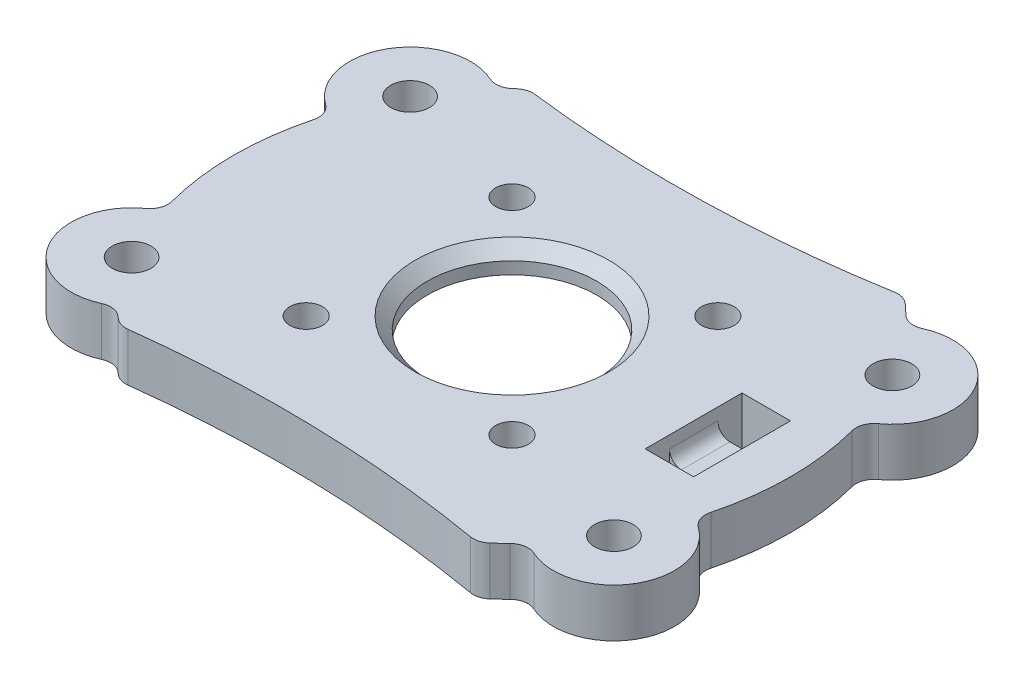
from build123d import *

# Parameters (mm, degrees)
SKETCH_1_R               = 23
SKETCH_1_R_2             = 13.6
SKETCH_1_R_3             = 5
EXTRUDE_1_DEPTH          = 4
CUT_EXTRUDE_1_DEPTH      = 4
PATTERN_CIRCULAR_1_COUNT = 2
CUT_EXTRUDE_START        = -10
CUT_EXTRUDE_2_DEPTH      = 10
FILLET_1_R               = 1.5
SKETCH_4_R               = 13.6
EXTRUDE_2_DEPTH          = 4
SKETCH_5_R               = 12.070826334
EXTRUDE_3_DEPTH          = 2
SKETCH_6_R               = 0.9
CUT_EXTRUDE_3_DEPTH      = 2
CUT_EXTRUDE_4_DEPTH      = 4.5
SKETCH_8_W               = 4
SKETCH_8_H               = 2
CUT_EXTRUDE_5_DEPTH      = 22
SKETCH_9_W               = 4
SKETCH_9_H               = 8
CUT_EXTRUDE_6_DEPTH      = 2
FILLET_2_R               = 1
FILLET_5_R               = 1.5
SKETCH_12_R              = 7
CUT_EXTRUDE_8_DEPTH      = 10
SKETCH_13_R              = 7
EXTRUDE_4_DEPTH          = 2
EXTRUDE_5_DEPTH          = 4
CHAMFER_1_SIZE           = 1
CUT_EXTRUDE_9_DEPTH      = 10
PATTERN_CIRCULAR_2_COUNT = 4
SKETCH_16_W              = 23.3
SKETCH_16_H              = 23.3
CUT_EXTRUDE_10_DEPTH     = 2
FILLET_6_R               = 2.9


with BuildPart() as part:
    # 草图1 → 凸台-拉伸1 (new body)
    # profile 1 of 5: a face of its own
    with BuildSketch(Plane(origin=(0, 0, 0), x_dir=(1, 0, 0), z_dir=(0, 1, 0))):
        Circle(SKETCH_1_R)
        with Locations(Location((0, 0, 0), (0, 0, 270))):
            Circle(SKETCH_1_R_2, mode=Mode.SUBTRACT)
    # profile 2 of 5: a face of its own
    with BuildSketch(Plane(origin=(0, 0, 0), x_dir=(1, 0, 0), z_dir=(0, 1, 0))):
        with Locations((-19.918584287, -11.5)):
            Circle(SKETCH_1_R_3)
    # profile 3 of 5: a face of its own
    with BuildSketch(Plane(origin=(0, 0, 0), x_dir=(1, 0, 0), z_dir=(0, 1, 0))):
        with Locations((19.918584287, -11.5)):
            Circle(SKETCH_1_R_3)
    # profile 4 of 5: a face of its own
    with BuildSketch(Plane(origin=(0, 0, 0), x_dir=(1, 0, 0), z_dir=(0, 1, 0))):
        with Locations((19.918584287, 11.5)):
            Circle(SKETCH_1_R_3)
    # profile 5 of 5: a face of its own
    with BuildSketch(Plane(origin=(0, 0, 0), x_dir=(1, 0, 0), z_dir=(0, 1, 0))):
        with Locations((-19.918584287, 11.5)):
            Circle(SKETCH_1_R_3)
    extrude(amount=-EXTRUDE_1_DEPTH)

    # 草图2 → 切除-拉伸1 (cut)
    with BuildSketch(Plane.XZ.offset(4)):
        with BuildLine():
            ThreePointArc((-19.918584287, 9.9), (-18.787213437, 10.36862915), (-18.318584287, 11.5))
            Line((-18.318584287, 11.5), (-19.918584287, 11.5))
            Line((-19.918584287, 11.5), (-19.918584287, 9.9))
        make_face()
        with BuildLine():
            Line((-19.918584287, 11.5), (-18.318584287, 11.5))
            ThreePointArc((-18.318584287, 11.5), (-21.049955137, 12.63137085), (-19.918584287, 9.9))
            Line((-19.918584287, 9.9), (-19.918584287, 11.5))
        make_face()
        with BuildLine():
            ThreePointArc((-19.918584287, 9.9), (-18.787213437, 10.36862915), (-18.318584287, 11.5))
            Line((-18.318584287, 11.5), (-19.918584287, 11.5))
            Line((-19.918584287, 11.5), (-19.918584287, 9.9))
        make_face()
        with BuildLine():
            Line((-19.918584287, 11.5), (-18.318584287, 11.5))
            ThreePointArc((-18.318584287, 11.5), (-21.049955137, 12.63137085), (-19.918584287, 9.9))
            Line((-19.918584287, 9.9), (-19.918584287, 11.5))
        make_face()
        with BuildLine():
            ThreePointArc((-19.918584287, -9.9), (-21.049955137, -12.63137085), (-18.318584287, -11.5))
            Line((-18.318584287, -11.5), (-19.918584287, -11.5))
            Line((-19.918584287, -11.5), (-19.918584287, -9.9))
        make_face()
        with BuildLine():
            Line((-19.918584287, -11.5), (-18.318584287, -11.5))
            ThreePointArc((-18.318584287, -11.5), (-18.787213437, -10.36862915), (-19.918584287, -9.9))
            Line((-19.918584287, -9.9), (-19.918584287, -11.5))
        make_face()
        with BuildLine():
            ThreePointArc((-19.918584287, -9.9), (-21.049955137, -12.63137085), (-18.318584287, -11.5))
            Line((-18.318584287, -11.5), (-19.918584287, -11.5))
            Line((-19.918584287, -11.5), (-19.918584287, -9.9))
        make_face()
        with BuildLine():
            Line((-19.918584287, -11.5), (-18.318584287, -11.5))
            ThreePointArc((-18.318584287, -11.5), (-18.787213437, -10.36862915), (-19.918584287, -9.9))
            Line((-19.918584287, -9.9), (-19.918584287, -11.5))
        make_face()
    cut_extrude_1 = extrude(amount=-CUT_EXTRUDE_1_DEPTH, mode=Mode.SUBTRACT)

    # 阵列(圆周)1: 切除-拉伸1 ×2 about axis
    pattern_circular_1_axis = Axis((0, 0, 0), (0, 1, 0))
    for i in range(1, PATTERN_CIRCULAR_1_COUNT):
        add(cut_extrude_1.rotate(pattern_circular_1_axis, i * 360 / PATTERN_CIRCULAR_1_COUNT), mode=Mode.SUBTRACT)

    # 草图3 → 切除-拉伸2 (cut)
    with BuildSketch(Plane.XZ.offset(4).offset(CUT_EXTRUDE_START)):
        with BuildLine():
            ThreePointArc((14.774295945, 17.627256716), (-0.556308738, 22.993271202), (-15.609472524, 16.892139223))
            ThreePointArc((-15.609472524, 16.892139223), (-0.389497448, 16.098651419), (14.774295945, 17.627256716))
        make_face()
        with BuildLine():
            ThreePointArc((-15.609472524, -16.892139223), (-0.556308738, -22.993271202), (14.774295945, -17.627256716))
            ThreePointArc((14.774295945, -17.627256716), (-0.389497448, -16.098651419), (-15.609472524, -16.892139223))
        make_face()
    extrude(amount=CUT_EXTRUDE_2_DEPTH, mode=Mode.SUBTRACT)

    # 圆角1
    fillet_1_edges = [part.edges().sort_by_distance(p)[0] for p in [
        (16.962730619, -2, 15.532732212),
        (-16.962730619, -2, 15.532732212),
        (-21.933105995, -2, 6.923789527),
        (-21.933105995, -2, -6.923789527),
        (-16.962730619, -2, -15.532732212),
        (16.962730619, -2, -15.532732212),
        (21.933105995, -2, -6.923789527),
        (21.933105995, -2, 6.923789527),
        (-15.609472524, -2, 16.892139223),
        (14.774295945, -2, 17.627256716),
        (14.774295945, -2, -17.627256716),
        (-15.609472524, -2, -16.892139223),
    ]]
    fillet(fillet_1_edges, radius=FILLET_1_R)


with BuildPart() as body_2:
    # 草图4 → 凸台-拉伸2 (new body)
    with BuildSketch(Plane.XZ.offset(4)):
        with Locations(Location((0, 0, 0), (0, 0, 90))):
            Circle(SKETCH_4_R)
        with BuildLine():
            ThreePointArc((-5.004997502, -7.6), (-6.776100977, -6.074080634), (-8.1, -4.147288271))
            Line((-8.1, -4.147288271), (-8.1, 4.147288271))
            ThreePointArc((-8.1, 4.147288271), (-6.776100977, 6.074080634), (-5.004997502, 7.6))
            Line((-5.004997502, 7.6), (5.004997502, 7.6))
            ThreePointArc((5.004997502, 7.6), (9.1, 0), (5.004997502, -7.6))
            Line((5.004997502, -7.6), (-5.004997502, -7.6))
        make_face(mode=Mode.SUBTRACT)
    extrude(amount=-EXTRUDE_2_DEPTH)

    # Combine 3: union part
    add(part.part)

    # 草图5 → 凸台-拉伸3 (add)
    with BuildSketch(Plane.XZ.offset(4)):
        Circle(SKETCH_5_R)
    extrude(amount=-EXTRUDE_3_DEPTH)

    # 草图6 → 切除-拉伸3 (cut)
    with BuildSketch(Plane(origin=(0, -2, 0), x_dir=(1, 0, 0), z_dir=(0, 1, 0))):
        with Locations(Location((0, 6, 0), (0, 0, 270))):
            Circle(SKETCH_6_R)
        with Locations(Location((0, -6, 0), (0, 0, 270))):
            Circle(SKETCH_6_R)
    extrude(amount=-CUT_EXTRUDE_3_DEPTH, mode=Mode.SUBTRACT)

    # 草图7 → 切除-拉伸4 (cut, symmetric)
    with BuildSketch(Plane(origin=(0, -2, 0), x_dir=(1, 0, 0), z_dir=(0, 1, 0))):
        with BuildLine():
            Line((7.603288762, -5), (12, -5))
            Line((12, -5), (12, 5))
            Line((12, 5), (7.603288762, 5))
            ThreePointArc((7.603288762, 5), (8.717795815, 2.609604593), (9.1, 0))
            ThreePointArc((9.1, 0), (8.717795815, -2.609604593), (7.603288762, -5))
        make_face()
    extrude(amount=CUT_EXTRUDE_4_DEPTH, both=True, mode=Mode.SUBTRACT)

    # 草图8 → 切除-拉伸5 (cut)
    with BuildSketch(Plane.XZ.offset(4)):
        with Locations((17, 3)):
            Rectangle(SKETCH_8_W, SKETCH_8_H)
        with Locations((17, -3)):
            Rectangle(SKETCH_8_W, SKETCH_8_H)
    extrude(amount=-CUT_EXTRUDE_5_DEPTH, mode=Mode.SUBTRACT)

    # 草图9 → 切除-拉伸6 (cut)
    with BuildSketch(Plane(origin=(0, 0, 0), x_dir=(1, 0, 0), z_dir=(0, 1, 0))):
        with Locations((17, 0)):
            Rectangle(SKETCH_9_W, SKETCH_9_H)
    extrude(amount=-CUT_EXTRUDE_6_DEPTH, mode=Mode.SUBTRACT)

    # 圆角2
    fillet_2_edges = [body_2.edges().sort_by_distance(p)[0] for p in [
        (15, -2, 0),
        (19, -2, 0),
    ]]
    fillet(fillet_2_edges, radius=FILLET_2_R)

    # 圆角5
    fillet_5_edges = [body_2.edges().sort_by_distance(p)[0] for p in [
        (7.603288762, -3, 5),
        (12, -2, -5),
        (12, -2, 5),
        (7.603288762, -3, -5),
    ]]
    fillet(fillet_5_edges, radius=FILLET_5_R)

    # 草图12 → 切除-拉伸8 (cut)
    with BuildSketch(Plane.XZ.offset(4)):
        with Locations(Location((0, 0, 0), (0, 0, 270))):
            Circle(SKETCH_12_R)
    extrude(amount=-CUT_EXTRUDE_8_DEPTH, mode=Mode.SUBTRACT)

    # 草图13 → 凸台-拉伸4 (add)
    with BuildSketch(Plane(origin=(0, -2, 0), x_dir=(1, 0, 0), z_dir=(0, 1, 0))):
        with BuildLine():
            ThreePointArc((-8.1, -4.147288271), (-6.776100977, -6.074080634), (-5.004997502, -7.6))
            Line((-5.004997502, -7.6), (5.004997502, -7.6))
            ThreePointArc((5.004997502, -7.6), (6.436786514, -6.432556208), (7.603288762, -5))
            Line((7.603288762, -5), (10.005498488, -5))
            ThreePointArc((10.005498488, -5), (8.782198744, -4.368065514), (8.589626061, -3.004716981))
            ThreePointArc((8.589626061, -3.004716981), (9.1, 0), (8.589626061, 3.004716981))
            ThreePointArc((8.589626061, 3.004716981), (8.782198744, 4.368065514), (10.005498488, 5))
            Line((10.005498488, 5), (7.603288762, 5))
            ThreePointArc((7.603288762, 5), (6.436786514, 6.432556208), (5.004997502, 7.6))
            Line((5.004997502, 7.6), (-5.004997502, 7.6))
            ThreePointArc((-5.004997502, 7.6), (-6.776100977, 6.074080634), (-8.1, 4.147288271))
            Line((-8.1, 4.147288271), (-8.1, -4.147288271))
        make_face()
        with Locations(Location((0, 0, 0), (0, 0, 90))):
            Circle(SKETCH_13_R, mode=Mode.SUBTRACT)
    extrude(amount=EXTRUDE_4_DEPTH)

    # 草图14 → 凸台-拉伸5 (add)
    with BuildSketch(Plane.XZ.offset(4)):
        with BuildLine():
            Line((12, 3.5), (12, -3.5))
            ThreePointArc((12, -3.5), (11.560660172, -4.560660172), (10.5, -5))
            Line((10.5, -5), (10.005498488, -5))
            ThreePointArc((10.005498488, -5), (8.782198744, -4.368065514), (8.589626061, -3.004716981))
            ThreePointArc((8.589626061, -3.004716981), (9.1, 0), (8.589626061, 3.004716981))
            ThreePointArc((8.589626061, 3.004716981), (8.782198744, 4.368065514), (10.005498488, 5))
            Line((10.005498488, 5), (10.5, 5))
            ThreePointArc((10.5, 5), (11.560660172, 4.560660172), (12, 3.5))
        make_face()
    extrude(amount=-EXTRUDE_5_DEPTH)

    # 倒角1
    chamfer_1_edges = [body_2.edges().sort_by_distance(p)[0] for p in [
        (0, 0, 7),
    ]]
    chamfer(chamfer_1_edges, length=CHAMFER_1_SIZE)

    # 草图15 → 切除-拉伸9 (cut)
    with BuildSketch(Plane.XZ.offset(4)):
        with BuildLine():
            ThreePointArc((-7.15, -8.5), (-7.545405845, -7.545405845), (-8.5, -7.15))
            Line((-8.5, -7.15), (-8.5, -8.5))
            Line((-8.5, -8.5), (-7.15, -8.5))
        make_face()
        with BuildLine():
            Line((-8.5, -8.5), (-8.5, -7.15))
            ThreePointArc((-8.5, -7.15), (-9.454594155, -9.454594155), (-7.15, -8.5))
            Line((-7.15, -8.5), (-8.5, -8.5))
        make_face()
        with BuildLine():
            ThreePointArc((-7.15, -8.5), (-7.545405845, -7.545405845), (-8.5, -7.15))
            Line((-8.5, -7.15), (-8.5, -8.5))
            Line((-8.5, -8.5), (-7.15, -8.5))
        make_face()
        with BuildLine():
            Line((-8.5, -8.5), (-8.5, -7.15))
            ThreePointArc((-8.5, -7.15), (-9.454594155, -9.454594155), (-7.15, -8.5))
            Line((-7.15, -8.5), (-8.5, -8.5))
        make_face()
    cut_extrude_9 = extrude(amount=-CUT_EXTRUDE_9_DEPTH, mode=Mode.SUBTRACT)

    # 阵列(圆周)2: 切除-拉伸9 ×4 about axis
    pattern_circular_2_axis = Axis((0, 0, 0), (0, 1, 0))
    for i in range(1, PATTERN_CIRCULAR_2_COUNT):
        add(cut_extrude_9.rotate(pattern_circular_2_axis, i * 360 / PATTERN_CIRCULAR_2_COUNT), mode=Mode.SUBTRACT)

    # 草图16 → 切除-拉伸10 (cut)
    with BuildSketch(Plane.XZ.offset(4)):
        Rectangle(SKETCH_16_W, SKETCH_16_H)
    extrude(amount=-CUT_EXTRUDE_10_DEPTH, mode=Mode.SUBTRACT)

    # 圆角6
    fillet_6_edges = [body_2.edges().sort_by_distance(p)[0] for p in [
        (-11.65, -3, -11.65),
        (-11.65, -3, 11.65),
        (11.65, -3, 11.65),
        (11.65, -3, -11.65),
    ]]
    fillet(fillet_6_edges, radius=FILLET_6_R)


solid = body_2.part
